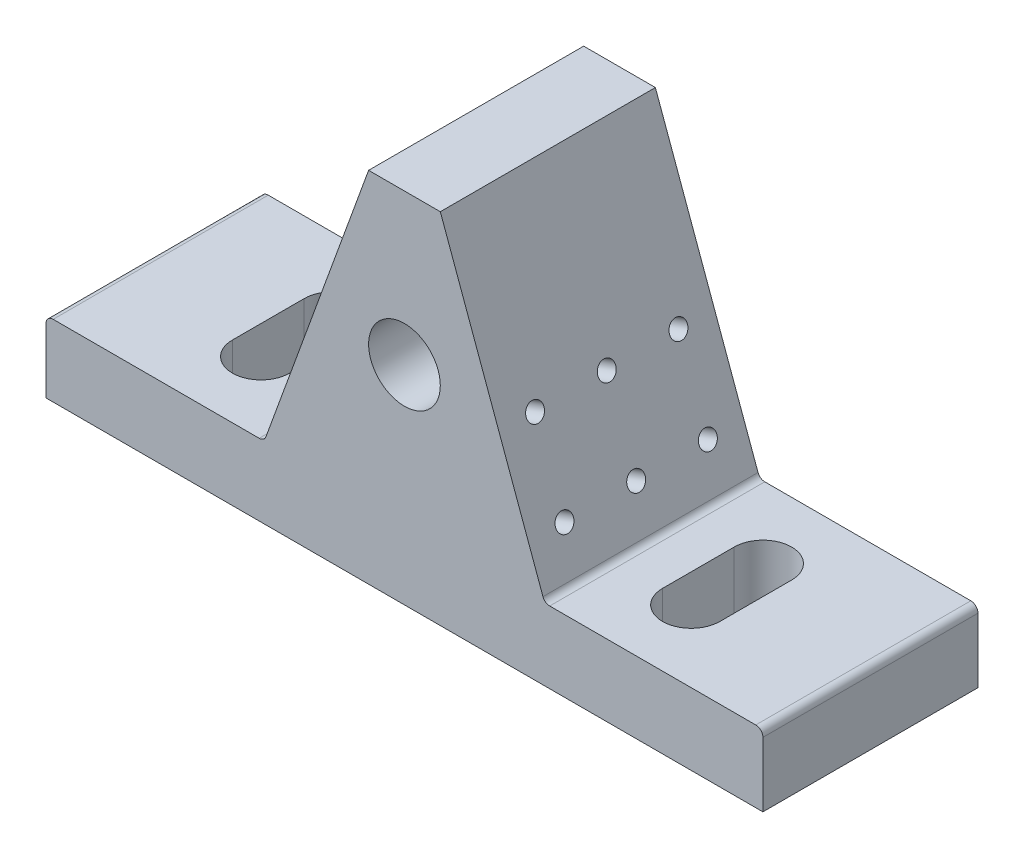
from build123d import *

# Parameters (mm, degrees)
BASE_EXTRUDE_DEPTH   = 15
SLOT_CUT_DEPTH       = 66.76473219
SKETCH3_R            = 5
GUIDE_HOLE_DEPTH     = 77.811457479
LPATTERN1_COUNT      = 3
LPATTERN1_PITCH      = 10
LPATTERN1_COUNT_DIR2 = 2
LPATTERN1_PITCH_DIR2 = 12
FILLET1_R            = 1


with BuildPart() as part:
    # Sketch1 → Base Extrude (new, symmetric)
    with BuildSketch(Plane.XY):
        Polygon((-50, 0), (50, 0), (50, 10), (19.558809371, 10), (5, 50), (-5, 50), (-19.558809371, 10), (-50, 10), align=None)
    extrude(amount=BASE_EXTRUDE_DEPTH, both=True)

    # Sketch2 → Slot Cut (cut, through all)
    with BuildSketch(Plane(origin=(0, 10, 0), x_dir=(1, 0, 0), z_dir=(0, 1, 0))):
        with BuildLine():
            Line((26, -5), (26, 5))
            ThreePointArc((26, 5), (30, 9), (34, 5))
            Line((34, 5), (34, -5))
            ThreePointArc((34, -5), (30, -9), (26, -5))
        make_face()
    slot_cut = extrude(amount=-SLOT_CUT_DEPTH, mode=Mode.SUBTRACT)

    # Mirror1: Slot Cut across plane
    add(slot_cut.mirror(Plane(origin=(0, 0, 0), x_dir=(0, 0, 1), z_dir=(1, 0, 0))), mode=Mode.SUBTRACT)

    # Sketch3 → Guide hole (cut, through all)
    with BuildSketch(Plane.XY.offset(15)):
        with Locations((0, 29)):
            Circle(SKETCH3_R)
    extrude(amount=-GUIDE_HOLE_DEPTH, mode=Mode.SUBTRACT)

    # Sketch10 → M3x0.5 Tapped Hole3 (revolve, cut)
    with BuildSketch(Plane(origin=(13.216501869, 27.425346647, 10), x_dir=(-0.3420201433256727, 0.939692620785907, 0), z_dir=(0, 0, 1))):
        Polygon((0, 0), (0, 8.251075774), (1.25, 7.5), (1.25, 0), align=None)
    m3x0_5_tapped_hole3 = revolve(axis=Axis((19.183550011, 29.597174557, 10), (-0.9396926207859069, -0.34202014332567277, 0)), mode=Mode.SUBTRACT)

    # LPattern1: M3x0.5 Tapped Hole3 3 × 2
    with Locations(*[Vector(0, 0, -1) * (i * LPATTERN1_PITCH) + Vector(0.34202014332567293, -0.9396926207859069, 0) * (j * LPATTERN1_PITCH_DIR2) for i in range(LPATTERN1_COUNT) for j in range(LPATTERN1_COUNT_DIR2) if (i, j) != (0, 0)]):
        add(m3x0_5_tapped_hole3, mode=Mode.SUBTRACT)

    # Fillet1
    fillet1_edges = [part.edges().sort_by_distance(p)[0] for p in [
        (-50, 10, 0),
        (-19.558809371, 10, 0),
        (19.558809371, 10, 0),
        (50, 10, 0),
    ]]
    fillet(fillet1_edges, radius=FILLET1_R)


solid = part.part
